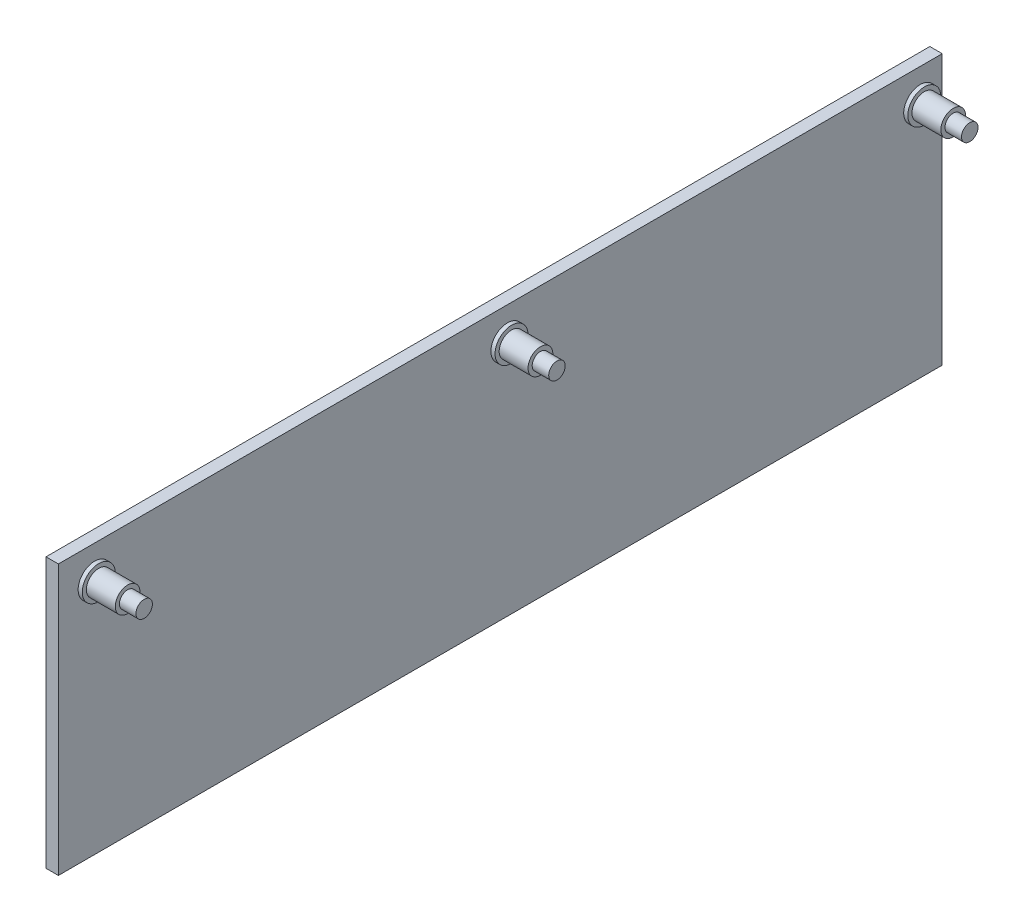
from build123d import *

# Parameters (mm, degrees)
SKETCH_1_W       = 214.117990109
SKETCH_1_H       = 65.359241046
EXTRUDE_1_DEPTH  = 3
SKETCH_2_R       = 2
EXTRUDE_2_DEPTH  = 12
SKETCH_3_R       = 2
EXTRUDE_3_DEPTH  = 12
SKETCH_4_R       = 2
EXTRUDE_4_DEPTH  = 12
SKETCH_5_R       = 3
EXTRUDE_5_DEPTH  = 8
SKETCH_6_R       = 4
EXTRUDE_6_DEPTH  = 1
SKETCH_7_R       = 3
EXTRUDE_7_DEPTH  = 8
SKETCH_8_R       = 3
EXTRUDE_8_DEPTH  = 8
SKETCH_9_R       = 4
EXTRUDE_9_DEPTH  = 1
SKETCH_10_R      = 4
EXTRUDE_10_DEPTH = 1


with BuildPart() as part:
    # 草图1 → 凸台-拉伸1 (new body)
    with BuildSketch(Plane(origin=(0, 0, 0), x_dir=(0, 0, -1), z_dir=(1, 0, 0))):
        with Locations((-107.058995055, 32.679620523)):
            Rectangle(SKETCH_1_W, SKETCH_1_H)
    extrude(amount=EXTRUDE_1_DEPTH)

    # 草图2 → 凸台-拉伸2 (add)
    with BuildSketch(Plane(origin=(3, 0, 0), x_dir=(0, 0, -1), z_dir=(1, 0, 0))):
        with Locations((-5.33476711, 57.554484424)):
            Circle(SKETCH_2_R)
    extrude(amount=EXTRUDE_2_DEPTH)

    # 草图3 → 凸台-拉伸3 (add)
    with BuildSketch(Plane(origin=(3, 0, 0), x_dir=(0, 0, -1), z_dir=(1, 0, 0))):
        with Locations((-105.33476711, 57.554484424)):
            Circle(SKETCH_3_R)
    extrude(amount=EXTRUDE_3_DEPTH)

    # 草图4 → 凸台-拉伸4 (add)
    with BuildSketch(Plane(origin=(3, 0, 0), x_dir=(0, 0, -1), z_dir=(1, 0, 0))):
        with Locations((-205.33476711, 57.554484424)):
            Circle(SKETCH_4_R)
    extrude(amount=EXTRUDE_4_DEPTH)

    # 草图5 → 凸台-拉伸5 (add)
    with BuildSketch(Plane(origin=(3, 0, 0), x_dir=(0, 0, -1), z_dir=(1, 0, 0))):
        with Locations((-5.33476711, 57.554484424)):
            Circle(SKETCH_5_R)
    extrude(amount=EXTRUDE_5_DEPTH)

    # 草图6 → 凸台-拉伸6 (add)
    with BuildSketch(Plane(origin=(3, 0, 0), x_dir=(0, 0, -1), z_dir=(1, 0, 0))):
        with Locations((-5.33476711, 57.554484424)):
            Circle(SKETCH_6_R)
    extrude(amount=EXTRUDE_6_DEPTH)

    # 草图7 → 凸台-拉伸7 (add)
    with BuildSketch(Plane(origin=(3, 0, 0), x_dir=(0, 0, -1), z_dir=(1, 0, 0))):
        with Locations((-105.33476711, 57.554484424)):
            Circle(SKETCH_7_R)
    extrude(amount=EXTRUDE_7_DEPTH)

    # 草图8 → 凸台-拉伸8 (add)
    with BuildSketch(Plane(origin=(3, 0, 0), x_dir=(0, 0, -1), z_dir=(1, 0, 0))):
        with Locations((-205.33476711, 57.554484424)):
            Circle(SKETCH_8_R)
    extrude(amount=EXTRUDE_8_DEPTH)

    # 草图9 → 凸台-拉伸9 (add)
    with BuildSketch(Plane(origin=(3, 0, 0), x_dir=(0, 0, -1), z_dir=(1, 0, 0))):
        with Locations((-105.33476711, 57.554484424)):
            Circle(SKETCH_9_R)
    extrude(amount=EXTRUDE_9_DEPTH)

    # 草图10 → 凸台-拉伸10 (add)
    with BuildSketch(Plane(origin=(3, 0, 0), x_dir=(0, 0, -1), z_dir=(1, 0, 0))):
        with Locations((-205.33476711, 57.554484424)):
            Circle(SKETCH_10_R)
    extrude(amount=EXTRUDE_10_DEPTH)


solid = part.part
